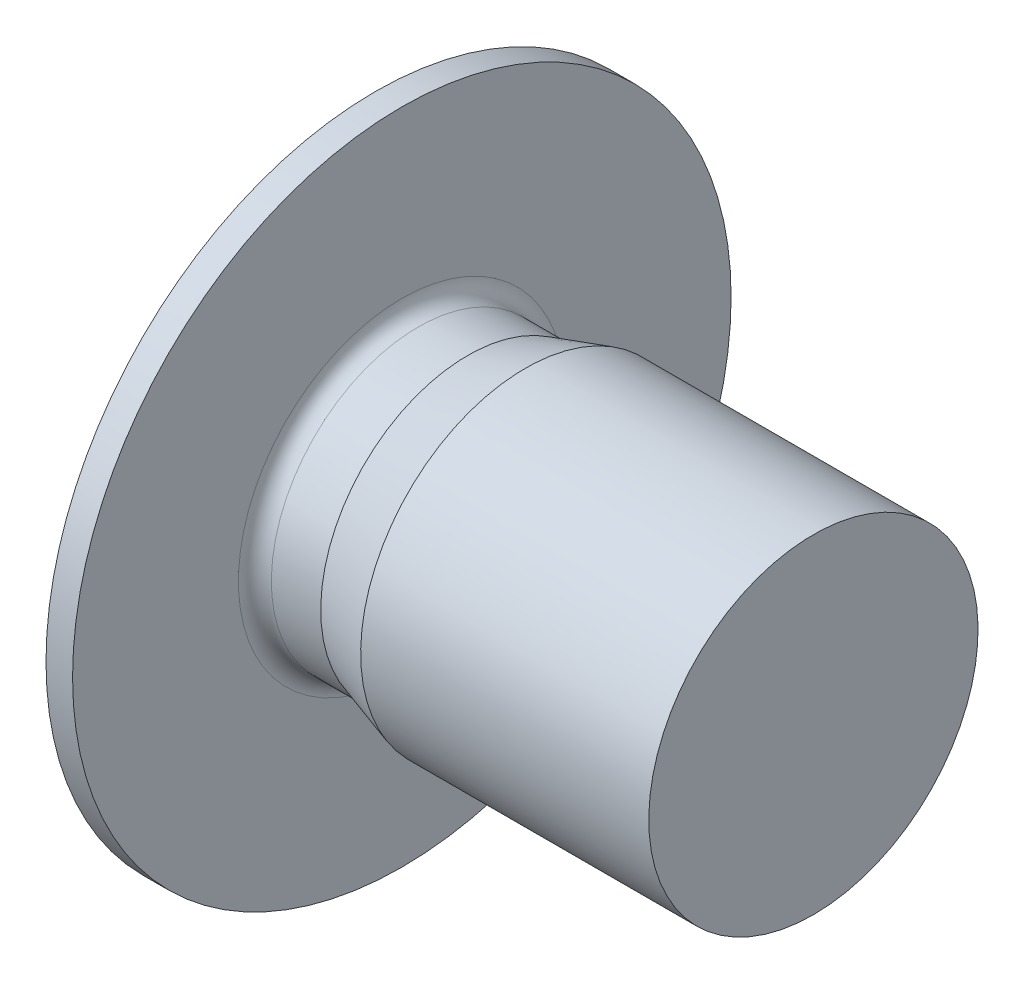
from build123d import *

# Parameters (mm, degrees)
FILLET1_R          = 0.2
CUT_EXTRUDE1_DEPTH = 2.5


with BuildPart() as part:
    # Sketch1 → Revolve1 (revolve)
    with BuildSketch(Plane.XY):
        Polygon((-0.9, 0), (-0.9, 3), (-0.322649731, 4), (0, 4), (0, 1.785), (0.8, 1.785), (1.5, 2), (5, 2), (5, 0), align=None)
    revolve(axis=Axis((-0.9, 0, 0), (1, 0, 0)))

    # Fillet1
    fillet1_edges = [part.edges().sort_by_distance(p)[0] for p in [
        (0, -1.785, 0),
    ]]
    fillet(fillet1_edges, radius=FILLET1_R)

    # Sketch2 → Cut-Extrude1 (cut)
    with BuildSketch(Plane.ZY.offset(0.9)):
        Polygon((0, 1.154700538), (-1, 0.577350269), (-1, -0.577350269), (0, -1.154700538), (1, -0.577350269), (1, 0.577350269), align=None)
    extrude(amount=-CUT_EXTRUDE1_DEPTH, mode=Mode.SUBTRACT)

    # Sketch3 → Cut-Revolve1 (revolve, cut)
    with BuildSketch(Plane.XY):
        Polygon((1.6, 0), (1.6, 1), (2.200860619, 0), align=None)
    revolve(axis=Axis((1.6, 0, 0), (1, 0, 0)), mode=Mode.SUBTRACT)


solid = part.part
